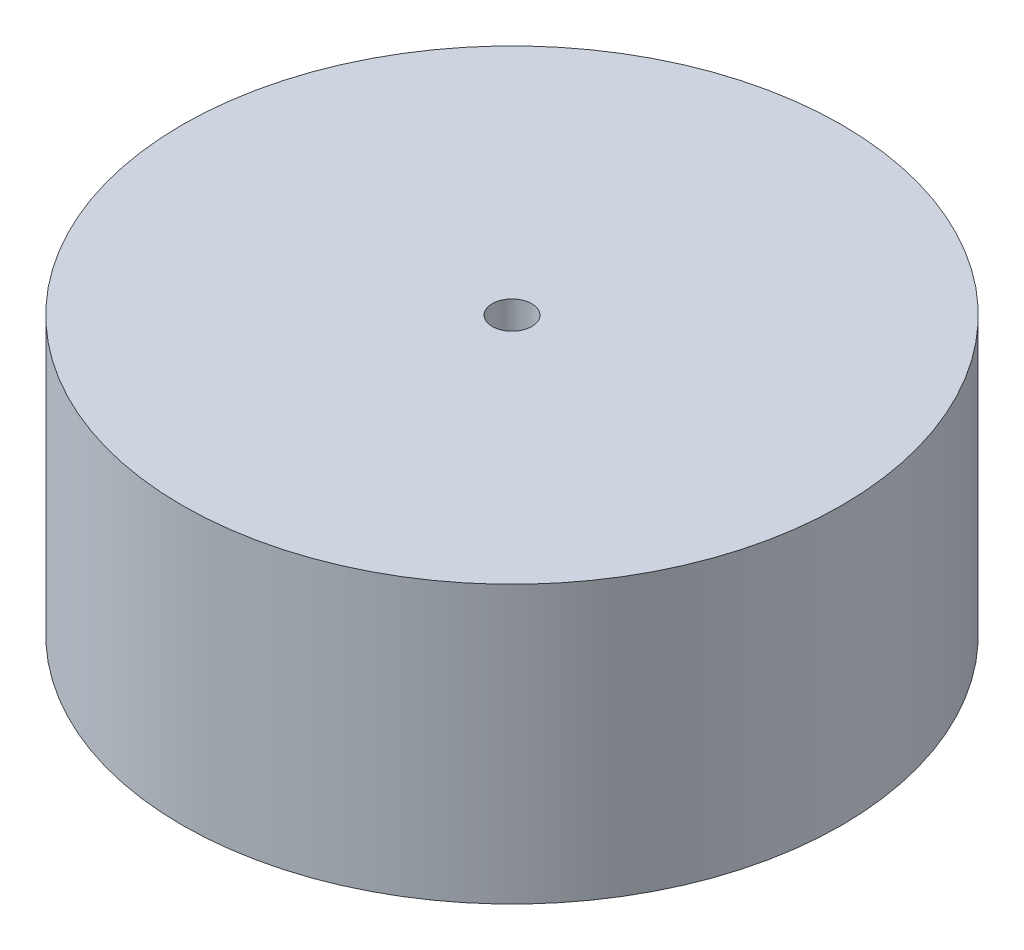
from build123d import *

# Parameters (mm, degrees)
ESQUISSE1_R      = 25
ESQUISSE1_R_2    = 1.5
EXTRUSION1_DEPTH = 21


with BuildPart() as part:
    # Esquisse1 → Extrusion1 (new body)
    with BuildSketch(Plane(origin=(0, 0, 0), x_dir=(1, 0, 0), z_dir=(0, 1, 0))):
        with Locations(Location((0, 0, 0), (0, 0, 90))):
            Circle(ESQUISSE1_R)
        with Locations(Location((0, 0, 0), (0, 0, 90))):
            Circle(ESQUISSE1_R_2, mode=Mode.SUBTRACT)
    extrude(amount=EXTRUSION1_DEPTH)


solid = part.part
